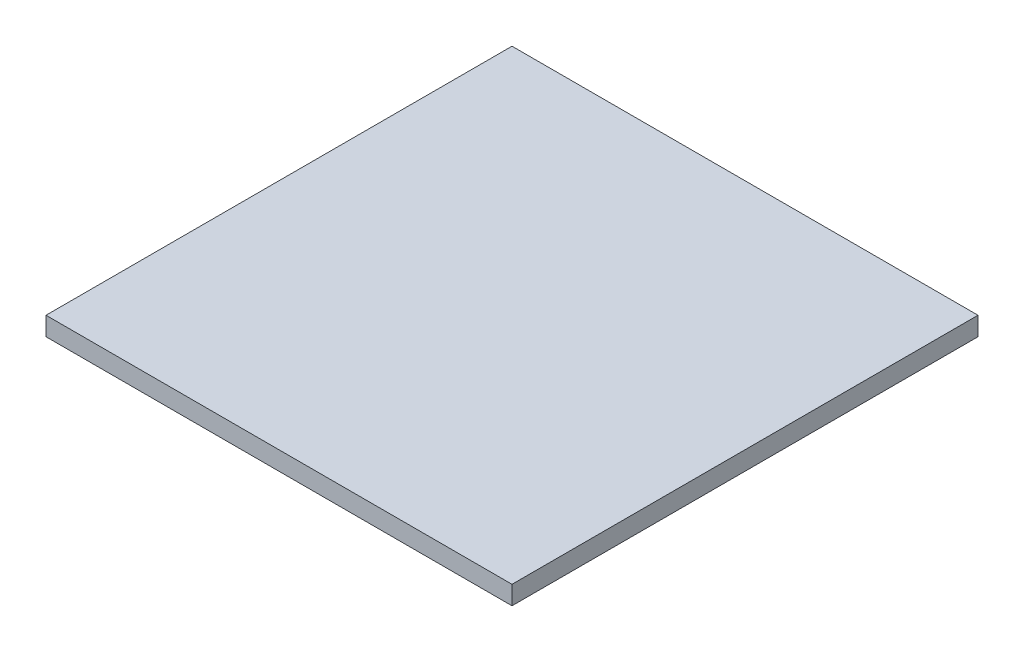
from build123d import *

# Parameters (mm, degrees)
SKETCH1_W           = 250
SKETCH1_H           = 250
BOSS_EXTRUDE1_DEPTH = 10


with BuildPart() as part:
    # Sketch1 → Boss-Extrude1 (new body)
    with BuildSketch(Plane(origin=(0, 0, 0), x_dir=(1, 0, 0), z_dir=(0, 1, 0))):
        with Locations((48.168448911, 54.918824806)):
            Rectangle(SKETCH1_W, SKETCH1_H)
    extrude(amount=BOSS_EXTRUDE1_DEPTH)


solid = part.part
